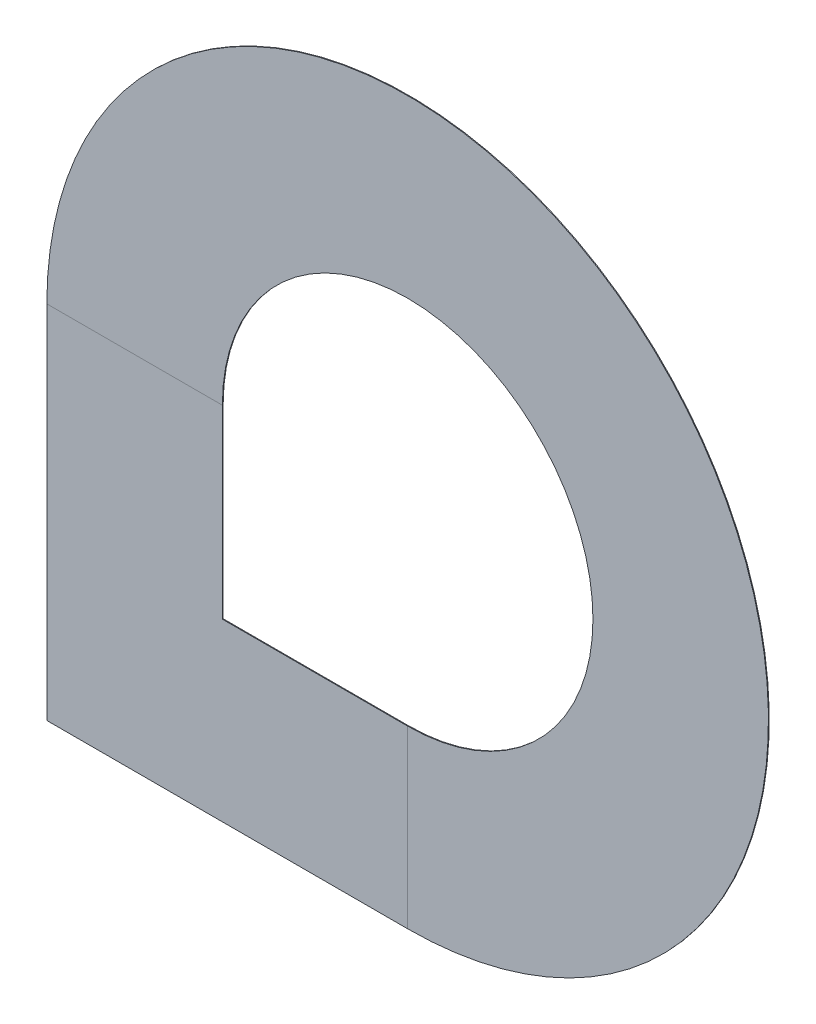
from build123d import *

# Parameters (mm, degrees)
SKETCH_2_W = 450
SKETCH_2_H = 2


with BuildPart() as part:
    # 扫描1: sweep along a path in 草图1
    with BuildLine(Plane.XY) as sweep_1_path:
        Line((0, 0), (0, 700))
        ThreePointArc((0, 700), (1194.974746831, 1194.974746831), (700, 0))
        Line((700, 0), (0, 0))
    # 草图2 → 扫描1 (sweep)
    with BuildSketch(Plane(origin=(0, 0, 0), x_dir=(1, 0, 0), z_dir=(0, 1, 0))):
        Rectangle(SKETCH_2_W, SKETCH_2_H)
    sweep(path=sweep_1_path.line, transition=Transition.RIGHT)


solid = part.part
